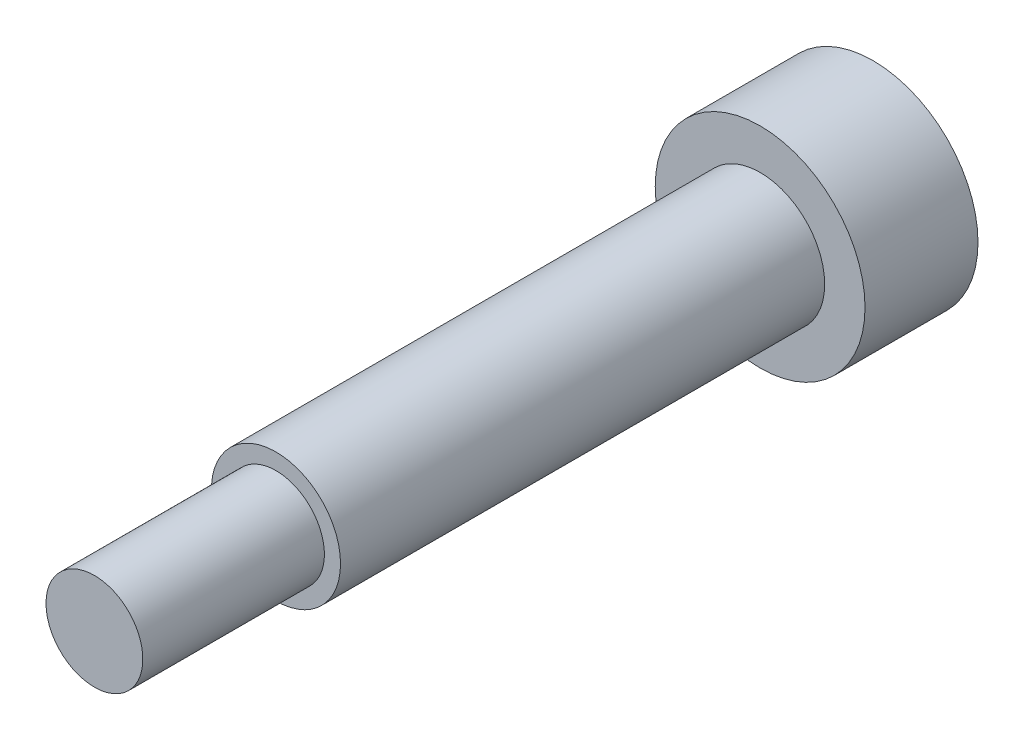
from build123d import *

# Parameters (mm, degrees)
SKETCH_1_R      = 6.5
EXTRUDE_1_DEPTH = 7
SKETCH_2_R      = 4
EXTRUDE_2_DEPTH = 30
SKETCH_3_R      = 3
EXTRUDE_3_DEPTH = 11.25


with BuildPart() as part:
    # 草图1 → 凸台-拉伸1 (new body)
    with BuildSketch(Plane.XY):
        Circle(SKETCH_1_R)
    extrude(amount=EXTRUDE_1_DEPTH)

    # 草图2 → 凸台-拉伸2 (add)
    with BuildSketch(Plane.XY.offset(7)):
        Circle(SKETCH_2_R)
    extrude(amount=EXTRUDE_2_DEPTH)

    # 草图3 → 凸台-拉伸3 (add)
    with BuildSketch(Plane.XY.offset(37)):
        with Locations(Location((0, 0, 0), (0, 0, 180))):
            Circle(SKETCH_3_R)
    extrude(amount=EXTRUDE_3_DEPTH)


solid = part.part
